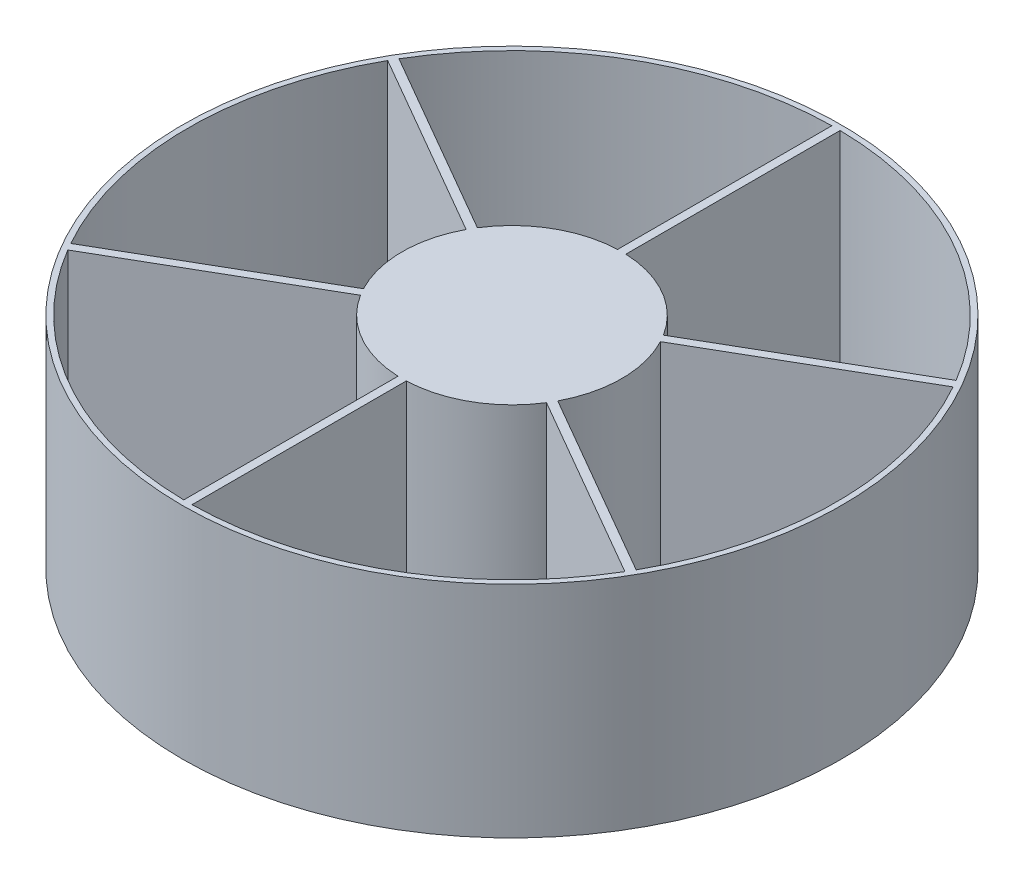
from build123d import *

# Parameters (mm, degrees)
SKETCH_1_R               = 120
SKETCH_1_R_2             = 38
EXTRUDE_1_DEPTH          = 80
SHELL_1_T                = -2
EXTRUDE_START            = -78
EXTRUDE_2_DEPTH          = 78
PATTERN_CIRCULAR_1_COUNT = 6
EXTRUDE_START_2          = -8
SKETCH_3_R               = 38
EXTRUDE_3_DEPTH          = 8
SKETCH_4_R               = 5
EXTRUDE_4_DEPTH          = 24
CUT_EXTRUDE_1_DEPTH      = 19
SKETCH_6_R               = 38
SKETCH_6_R_2             = 5
CUT_EXTRUDE_2_DEPTH      = 3


with BuildPart() as part:
    # 草图1 → 凸台-拉伸1 (new body)
    with BuildSketch(Plane(origin=(0, 0, 0), x_dir=(1, 0, 0), z_dir=(0, 1, 0))):
        with Locations(Location((0, 0, 0), (0, 0, 270))):
            Circle(SKETCH_1_R)
        with Locations(Location((0, 0, 0), (0, 0, 270))):
            Circle(SKETCH_1_R_2, mode=Mode.SUBTRACT)
    extrude(amount=EXTRUDE_1_DEPTH)

    # 抽壳1
    shell_1_openings = [part.faces().sort_by_distance(p)[0] for p in [
        (0, 80, -116.60588745),
    ]]
    offset(amount=SHELL_1_T, openings=shell_1_openings, kind=Kind.INTERSECTION)

    # 草图2 → 凸台-拉伸2 (add)
    with BuildSketch(Plane(origin=(0, 80, 0), x_dir=(1, 0, 0), z_dir=(0, 1, 0)).offset(EXTRUDE_START)):
        with BuildLine():
            Line((-1.5, 117.990465717), (-1.5, 39.971865105))
            ThreePointArc((-1.5, 39.971865105), (0, 40), (1.5, 39.971865105))
            Line((1.5, 39.971865105), (1.5, 117.990465717))
            ThreePointArc((1.5, 117.990465717), (0, 118), (-1.5, 117.990465717))
        make_face()
    extrude_2 = extrude(amount=EXTRUDE_2_DEPTH)

    # 阵列(圆周)1: 凸台-拉伸2 ×6 about axis
    pattern_circular_1_axis = Axis((0, 0, 0), (0, 1, 0))
    for i in range(1, PATTERN_CIRCULAR_1_COUNT):
        add(extrude_2.rotate(pattern_circular_1_axis, i * 360 / PATTERN_CIRCULAR_1_COUNT))

    # 草图3 → 凸台-拉伸3 (add)
    with BuildSketch(Plane(origin=(0, 80, 0), x_dir=(1, 0, 0), z_dir=(0, 1, 0)).offset(EXTRUDE_START_2)):
        with Locations(Location((0, 0, 0), (0, 0, 270))):
            Circle(SKETCH_3_R)
    extrude(amount=EXTRUDE_3_DEPTH)

    # 草图4 → 凸台-拉伸4 (add)
    with BuildSketch(Plane.XZ.offset(-72)):
        with Locations(Location((0, 0, 0), (0, 0, 90))):
            Circle(SKETCH_4_R)
    extrude(amount=EXTRUDE_4_DEPTH)

    # 草图5 → 切除-拉伸1 (cut)
    with BuildSketch(Plane.XZ.offset(-48)):
        with BuildLine():
            Line((-2.049390153, 1.6), (-2.049390153, -1.6))
            ThreePointArc((-2.049390153, -1.6), (2.6, 0), (-2.049390153, 1.6))
        make_face()
    extrude(amount=-CUT_EXTRUDE_1_DEPTH, mode=Mode.SUBTRACT)

    # 草图6 → 切除-拉伸2 (cut)
    with BuildSketch(Plane.XZ.offset(-72)):
        with Locations(Location((0, 0, 0), (0, 0, 270))):
            Circle(SKETCH_6_R)
        with Locations(Location((0, 0, 0), (0, 0, 270))):
            Circle(SKETCH_6_R_2, mode=Mode.SUBTRACT)
    extrude(amount=-CUT_EXTRUDE_2_DEPTH, mode=Mode.SUBTRACT)


solid = part.part
